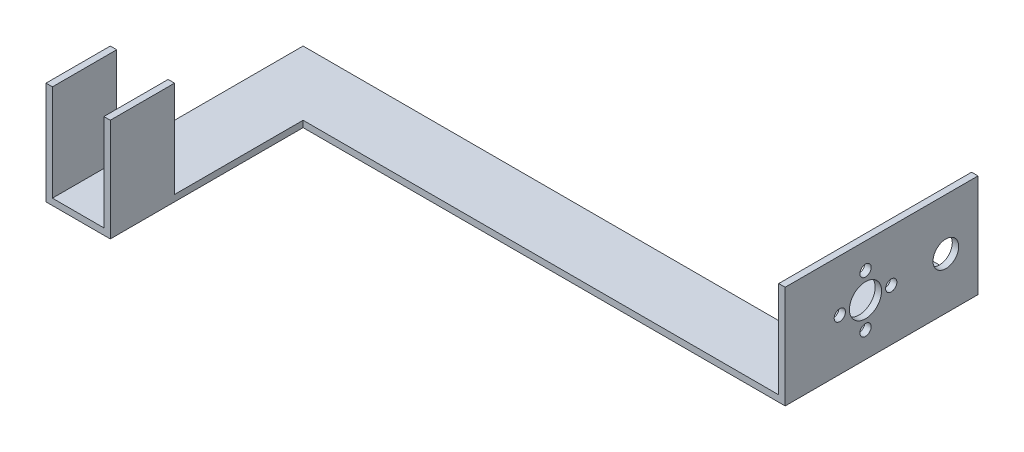
from build123d import *

# Parameters (mm, degrees)
BOSS_EXTRUDE1_DEPTH = 2
SKETCH2_W           = 2
SKETCH2_H           = 20
SKETCH2_H_2         = 60
BOSS_EXTRUDE2_DEPTH = 30
CUT_EXTRUDE1_REACH  = 212.533
SKETCH3_R           = 5
SKETCH3_R_2         = 1.75
SKETCH3_R_3         = 4


with BuildPart() as part:
    # Sketch1 → Boss-Extrude1 (new body)
    with BuildSketch(Plane(origin=(0, 0, 0), x_dir=(1, 0, 0), z_dir=(0, 1, 0))):
        Polygon((150, 120), (150, 60), (0, 60), (0, 0), (-20, 0), (-20, 80), (130, 80), (130, 120), align=None)
    extrude(amount=BOSS_EXTRUDE1_DEPTH)

    # Sketch2 → Boss-Extrude2 (add)
    with BuildSketch(Plane(origin=(0, 2, 0), x_dir=(1, 0, 0), z_dir=(0, 1, 0))):
        with Locations((-19, 10)):
            Rectangle(SKETCH2_W, SKETCH2_H)
        with Locations((-1, 10)):
            Rectangle(SKETCH2_W, SKETCH2_H)
        with Locations((149, 90)):
            Rectangle(SKETCH2_W, SKETCH2_H_2)
    extrude(amount=BOSS_EXTRUDE2_DEPTH)

    # Sketch3 → Cut-Extrude1 (cut, up to next)
    with BuildSketch(Plane(origin=(150, 0, 0), x_dir=(0, 0, -1), z_dir=(1, 0, 0)), mode=Mode.PRIVATE) as cut_extrude1_sk1:
        with Locations((85, 16)):
            Circle(SKETCH3_R)
    cut_extrude1_tool1 = extrude(cut_extrude1_sk1.sketch, amount=-CUT_EXTRUDE1_REACH, mode=Mode.PRIVATE) & part.part
    # Sketch3 → Cut-Extrude1 (cut, up to next)
    with BuildSketch(Plane(origin=(150, 0, 0), x_dir=(0, 0, -1), z_dir=(1, 0, 0)), mode=Mode.PRIVATE) as cut_extrude1_sk2:
        with Locations((85, 24)):
            Circle(SKETCH3_R_2)
    cut_extrude1_tool2 = extrude(cut_extrude1_sk2.sketch, amount=-CUT_EXTRUDE1_REACH, mode=Mode.PRIVATE) & part.part
    # Sketch3 → Cut-Extrude1 (cut, up to next)
    with BuildSketch(Plane(origin=(150, 0, 0), x_dir=(0, 0, -1), z_dir=(1, 0, 0)), mode=Mode.PRIVATE) as cut_extrude1_sk3:
        with Locations((93, 16)):
            Circle(SKETCH3_R_2)
    cut_extrude1_tool3 = extrude(cut_extrude1_sk3.sketch, amount=-CUT_EXTRUDE1_REACH, mode=Mode.PRIVATE) & part.part
    # Sketch3 → Cut-Extrude1 (cut, up to next)
    with BuildSketch(Plane(origin=(150, 0, 0), x_dir=(0, 0, -1), z_dir=(1, 0, 0)), mode=Mode.PRIVATE) as cut_extrude1_sk4:
        with Locations((85, 8)):
            Circle(SKETCH3_R_2)
    cut_extrude1_tool4 = extrude(cut_extrude1_sk4.sketch, amount=-CUT_EXTRUDE1_REACH, mode=Mode.PRIVATE) & part.part
    # Sketch3 → Cut-Extrude1 (cut, up to next)
    with BuildSketch(Plane(origin=(150, 0, 0), x_dir=(0, 0, -1), z_dir=(1, 0, 0)), mode=Mode.PRIVATE) as cut_extrude1_sk5:
        with Locations((77, 16)):
            Circle(SKETCH3_R_2)
    cut_extrude1_tool5 = extrude(cut_extrude1_sk5.sketch, amount=-CUT_EXTRUDE1_REACH, mode=Mode.PRIVATE) & part.part
    # Sketch3 → Cut-Extrude1 (cut, up to next)
    with BuildSketch(Plane(origin=(150, 0, 0), x_dir=(0, 0, -1), z_dir=(1, 0, 0)), mode=Mode.PRIVATE) as cut_extrude1_sk6:
        with Locations((110, 16)):
            Circle(SKETCH3_R_3)
    cut_extrude1_tool6 = extrude(cut_extrude1_sk6.sketch, amount=-CUT_EXTRUDE1_REACH, mode=Mode.PRIVATE) & part.part
    add(cut_extrude1_tool1.solids().sort_by_distance((150, 16, -85))[0], mode=Mode.SUBTRACT)
    add(cut_extrude1_tool2.solids().sort_by_distance((150, 24, -85))[0], mode=Mode.SUBTRACT)
    add(cut_extrude1_tool3.solids().sort_by_distance((150, 16, -93))[0], mode=Mode.SUBTRACT)
    add(cut_extrude1_tool4.solids().sort_by_distance((150, 8, -85))[0], mode=Mode.SUBTRACT)
    add(cut_extrude1_tool5.solids().sort_by_distance((150, 16, -77))[0], mode=Mode.SUBTRACT)
    add(cut_extrude1_tool6.solids().sort_by_distance((150, 16, -110))[0], mode=Mode.SUBTRACT)


solid = part.part
